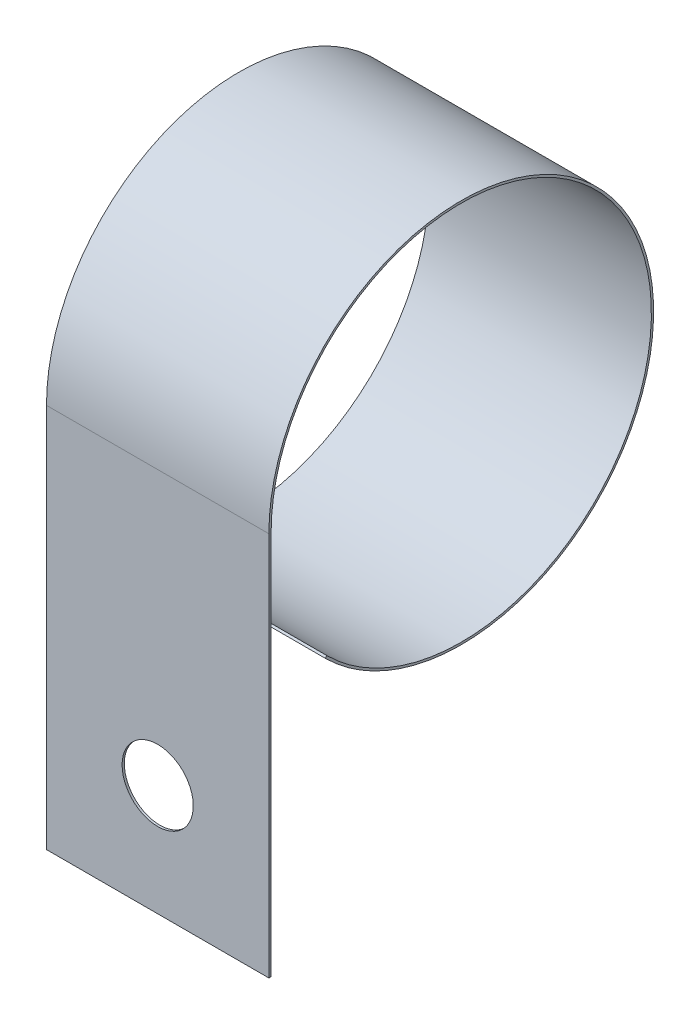
from build123d import *

# Parameters (mm, degrees)
BOSS_EXTRUDE1_DEPTH = 5
CUT_EXTRUDE1_REACH  = 26.972
SKETCH2_R           = 1.6


with BuildPart() as part:
    # Sketch1 → Boss-Extrude1 (new, symmetric)
    with BuildSketch(Plane(origin=(0, 0, 0), x_dir=(0, -1, 0), z_dir=(1, 0, 0))):
        with BuildLine():
            Line((6.116473657, -6.116473657), (6.045762979, -6.045762979))
            ThreePointArc((6.045762979, -6.045762979), (-3.271943347, 7.899170003), (0, -8.55))
            Line((0, -8.55), (17.3, -8.55))
            Line((17.3, -8.55), (17.3, -8.65))
            Line((17.3, -8.65), (0, -8.65))
            ThreePointArc((0, -8.65), (-3.31021169, 7.991557956), (6.116473657, -6.116473657))
        make_face()
    extrude(amount=BOSS_EXTRUDE1_DEPTH, both=True)

    # Sketch2 → Cut-Extrude1 (cut, up to next)
    with BuildSketch(Plane(origin=(0, 0, 8.65), x_dir=(-1, 0, 0), z_dir=(0, 0, -1)), mode=Mode.PRIVATE) as cut_extrude1_sk1:
        with Locations(Location((0, -12.3, 0), (0, 0, 270))):
            Circle(SKETCH2_R)
    cut_extrude1_tool1 = extrude(cut_extrude1_sk1.sketch, amount=CUT_EXTRUDE1_REACH, mode=Mode.PRIVATE) & part.part
    add(cut_extrude1_tool1.solids().sort_by_distance((0, -12.3, 8.65))[0], mode=Mode.SUBTRACT)


solid = part.part
